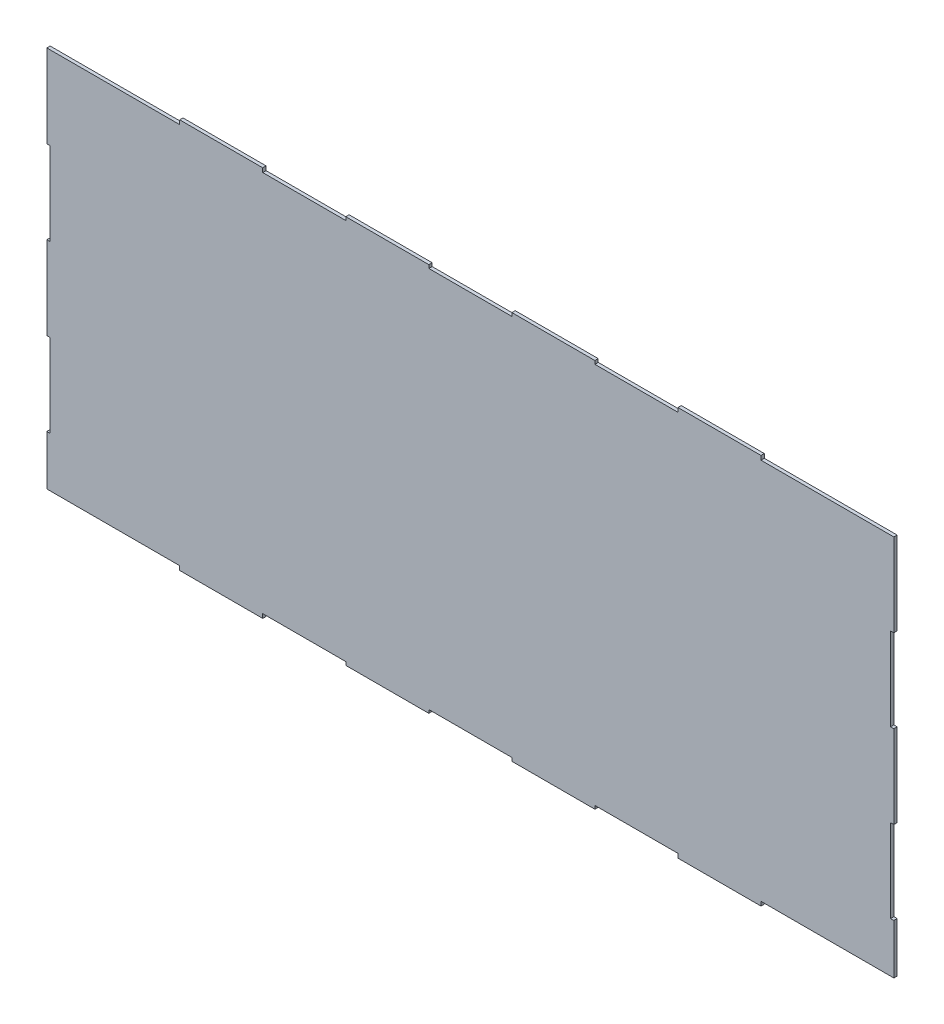
from build123d import *

# Parameters (mm, degrees)
EXTRUDE_1_DEPTH = 4


with BuildPart() as part:
    # 草图2 → 凸台-拉伸1 (new body)
    with BuildSketch(Plane.XY):
        Polygon((-510, 230), (-350, 230), (-350, 235), (-250, 235), (-250, 230), (-150, 230), (-150, 234), (-50, 234), (-50, 230), (50, 230), (50, 234), (150, 234), (150, 230), (250, 230), (250, 235), (350, 235), (350, 230), (510, 230), (510, 130), (506, 130), (506, 30), (510, 30), (510, -70), (506, -70), (506, -170), (510, -170), (510, -230), (350, -230), (350, -235), (250, -235), (250, -230), (150, -230), (150, -234), (50, -234), (50, -230), (-50, -230), (-50, -234), (-150, -234), (-150, -230), (-250, -230), (-250, -235), (-350, -235), (-350, -230), (-510, -230), (-510, -170), (-506, -170), (-506, -70), (-510, -70), (-510, 30), (-506, 30), (-506, 130), (-510, 130), align=None)
    extrude(amount=EXTRUDE_1_DEPTH)


solid = part.part
